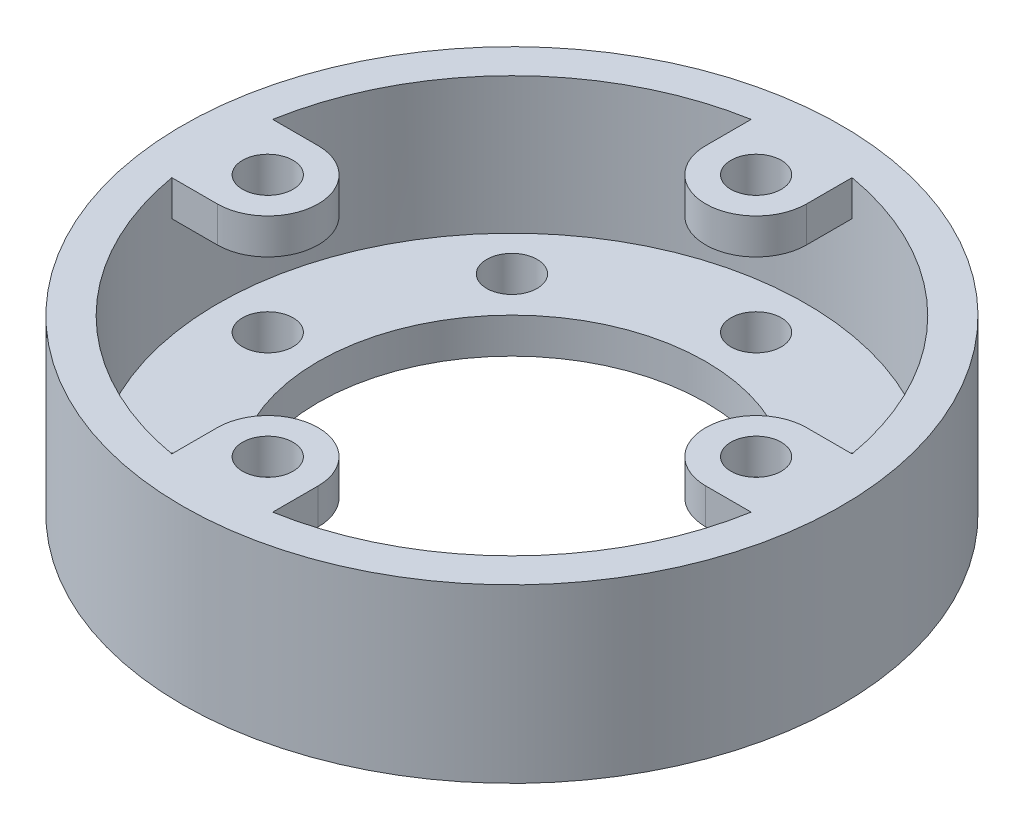
from build123d import *

# Parameters (mm, degrees)
SKETCH11_R          = 73.025
SKETCH11_R_2        = 42.926
SKETCH11_R_3        = 5.588
BOSS_EXTRUDE3_DEPTH = 7.874
SKETCH12_R          = 73.025
SKETCH12_R_2        = 65.151
BOSS_EXTRUDE4_DEPTH = 30.226
BOSS_EXTRUDE5_START = -7.874
SKETCH19_R          = 5.588
BOSS_EXTRUDE5_DEPTH = 7.874


with BuildPart() as part:
    # Sketch11 → Boss-Extrude3 (new body)
    with BuildSketch(Plane(origin=(0, 0, 0), x_dir=(1, 0, 0), z_dir=(0, 1, 0))):
        with Locations(Location((0, 0, 0), (0, 0, 270))):
            Circle(SKETCH11_R)
        with Locations(Location((0, 0, 0), (0, 0, 270))):
            Circle(SKETCH11_R_2, mode=Mode.SUBTRACT)
        with Locations(Location((0, -54.102, 0), (0, 0, 270))):
            Circle(SKETCH11_R_3, mode=Mode.SUBTRACT)
        with Locations(Location((-38.255891076, -38.255891076, 0), (0, 0, 270))):
            Circle(SKETCH11_R_3, mode=Mode.SUBTRACT)
        with Locations(Location((-54.102, 0, 0), (0, 0, 270))):
            Circle(SKETCH11_R_3, mode=Mode.SUBTRACT)
        with Locations(Location((-38.255891076, 38.255891076, 0), (0, 0, 270))):
            Circle(SKETCH11_R_3, mode=Mode.SUBTRACT)
        with Locations(Location((0, 54.102, 0), (0, 0, 270))):
            Circle(SKETCH11_R_3, mode=Mode.SUBTRACT)
        with Locations(Location((38.255891076, 38.255891076, 0), (0, 0, 270))):
            Circle(SKETCH11_R_3, mode=Mode.SUBTRACT)
        with Locations(Location((54.102, 0, 0), (0, 0, 270))):
            Circle(SKETCH11_R_3, mode=Mode.SUBTRACT)
        with Locations(Location((38.255891076, -38.255891076, 0), (0, 0, 270))):
            Circle(SKETCH11_R_3, mode=Mode.SUBTRACT)
    extrude(amount=BOSS_EXTRUDE3_DEPTH)

    # Sketch12 → Boss-Extrude4 (add)
    with BuildSketch(Plane(origin=(0, 7.874, 0), x_dir=(1, 0, 0), z_dir=(0, 1, 0))):
        with Locations(Location((0, 0, 0), (0, 0, 270))):
            Circle(SKETCH12_R)
        with Locations(Location((0, 0, 0), (0, 0, 270))):
            Circle(SKETCH12_R_2, mode=Mode.SUBTRACT)
    extrude(amount=BOSS_EXTRUDE4_DEPTH)

    # Sketch19 → Boss-Extrude5 (add)
    # profile 1 of 4: a face of its own
    with BuildSketch(Plane(origin=(0, 38.1, 0), x_dir=(1, 0, 0), z_dir=(0, 1, 0)).offset(BOSS_EXTRUDE5_START)):
        with BuildLine():
            Line((-11.176, -54.102), (-11.176, -72.164725795))
            Line((-11.176, -72.164725795), (11.176, -72.164725795))
            Line((11.176, -72.164725795), (11.176, -54.102))
            ThreePointArc((11.176, -54.102), (0, -42.926), (-11.176, -54.102))
        make_face()
        with Locations(Location((0, -54.102, 0), (0, 0, 270))):
            Circle(SKETCH19_R, mode=Mode.SUBTRACT)
    # profile 2 of 4: a face of its own
    with BuildSketch(Plane(origin=(0, 38.1, 0), x_dir=(1, 0, 0), z_dir=(0, 1, 0)).offset(BOSS_EXTRUDE5_START)):
        with BuildLine():
            Line((-54.102, 11.176), (-72.164725795, 11.176))
            Line((-72.164725795, 11.176), (-72.164725795, -11.176))
            Line((-72.164725795, -11.176), (-54.102, -11.176))
            ThreePointArc((-54.102, -11.176), (-42.926, 0), (-54.102, 11.176))
        make_face()
        with Locations(Location((-54.102, 0, 0), (0, 0, 270))):
            Circle(SKETCH19_R, mode=Mode.SUBTRACT)
    # profile 3 of 4: a face of its own
    with BuildSketch(Plane(origin=(0, 38.1, 0), x_dir=(1, 0, 0), z_dir=(0, 1, 0)).offset(BOSS_EXTRUDE5_START)):
        with BuildLine():
            Line((11.176, 54.102), (11.176, 72.164725795))
            Line((11.176, 72.164725795), (-11.176, 72.164725795))
            Line((-11.176, 72.164725795), (-11.176, 54.102))
            ThreePointArc((-11.176, 54.102), (0, 42.926), (11.176, 54.102))
        make_face()
        with Locations(Location((0, 54.102, 0), (0, 0, 270))):
            Circle(SKETCH19_R, mode=Mode.SUBTRACT)
    # profile 4 of 4: a face of its own
    with BuildSketch(Plane(origin=(0, 38.1, 0), x_dir=(1, 0, 0), z_dir=(0, 1, 0)).offset(BOSS_EXTRUDE5_START)):
        with BuildLine():
            Line((54.102, -11.176), (72.164725795, -11.176))
            Line((72.164725795, -11.176), (72.164725795, 11.176))
            Line((72.164725795, 11.176), (54.102, 11.176))
            ThreePointArc((54.102, 11.176), (42.926, 0), (54.102, -11.176))
        make_face()
        with Locations(Location((54.102, 0, 0), (0, 0, 270))):
            Circle(SKETCH19_R, mode=Mode.SUBTRACT)
    extrude(amount=BOSS_EXTRUDE5_DEPTH)


solid = part.part
